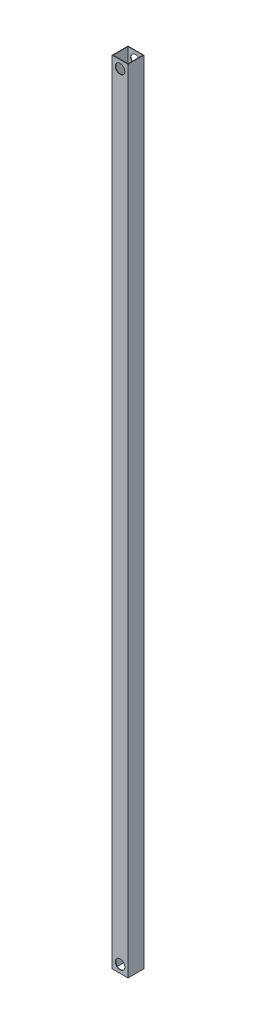
from build123d import *

# Parameters (mm, degrees)
CROQUIS1_W              = 10
CROQUIS1_H              = 10
SALIENTE_EXTRUIR1_DEPTH = 500
CROQUIS2_W              = 9.366
CROQUIS2_H              = 9.366
CORTAR_EXTRUIR1_DEPTH   = 500
CROQUIS3_R              = 3
CORTAR_EXTRUIR2_DEPTH   = 500
CROQUIS4_R              = 3
CORTAR_EXTRUIR3_DEPTH   = 500


with BuildPart() as part:
    # Croquis1 → Saliente-Extruir1 (new body)
    with BuildSketch(Plane(origin=(0, 0, 0), x_dir=(1, 0, 0), z_dir=(0, 1, 0))):
        Rectangle(CROQUIS1_W, CROQUIS1_H)
    extrude(amount=SALIENTE_EXTRUIR1_DEPTH)

    # Croquis2 → Cortar-Extruir1 (cut)
    with BuildSketch(Plane(origin=(0, 500, 0), x_dir=(1, 0, 0), z_dir=(0, 1, 0))):
        Rectangle(CROQUIS2_W, CROQUIS2_H)
    extrude(amount=-CORTAR_EXTRUIR1_DEPTH, mode=Mode.SUBTRACT)

    # Croquis3 → Cortar-Extruir2 (cut)
    with BuildSketch(Plane.XY.offset(5)):
        with Locations((0, 5)):
            Circle(CROQUIS3_R)
    extrude(amount=-CORTAR_EXTRUIR2_DEPTH, mode=Mode.SUBTRACT)

    # Croquis4 → Cortar-Extruir3 (cut)
    with BuildSketch(Plane.XY.offset(5)):
        with Locations((0, 495)):
            Circle(CROQUIS4_R)
    extrude(amount=-CORTAR_EXTRUIR3_DEPTH, mode=Mode.SUBTRACT)


solid = part.part
